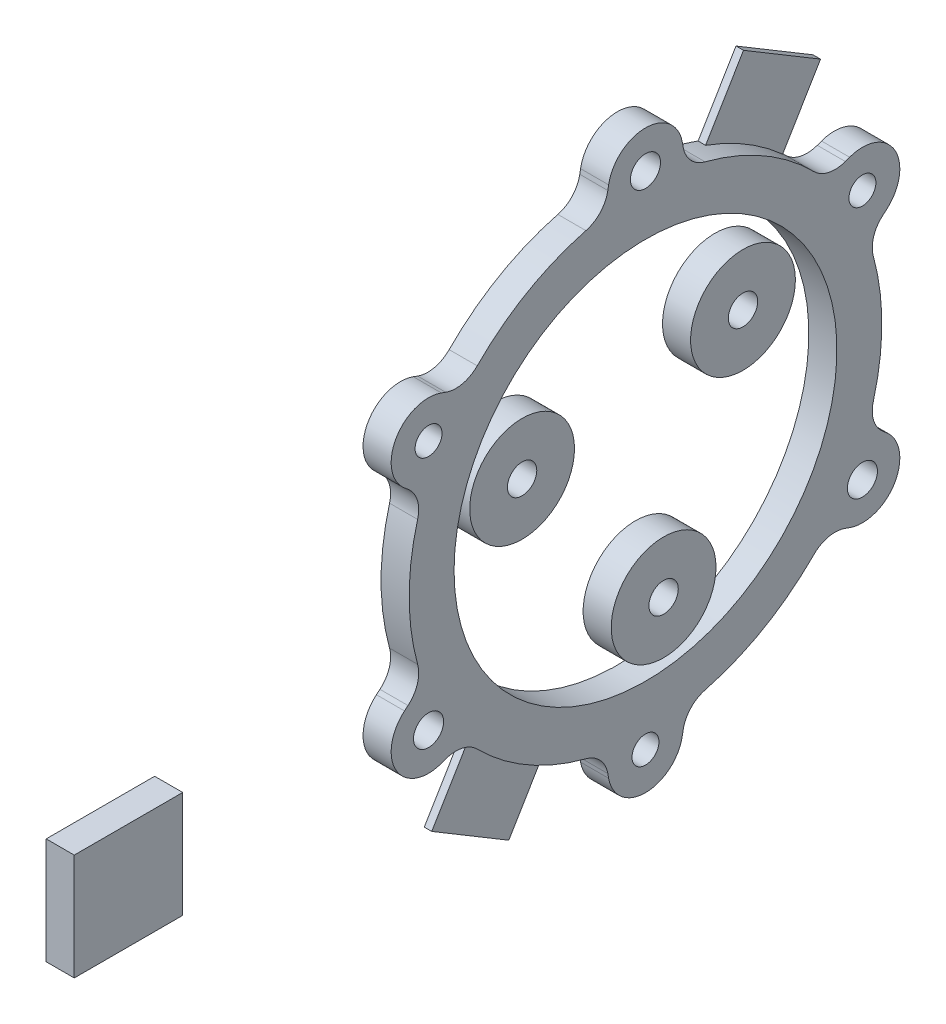
from build123d import *

# Parameters (mm, degrees)
BOSS_EXTRUDE1_DEPTH    = 4.7625
FILLET1_R              = 5.08
CIRPATTERN2_COUNT      = 6
F_10_CLEARANCE_HOLE1_D = 5.1054
SKETCH4_R              = 2.286
CUT_EXTRUDE1_DEPTH     = 66.356339539
SKETCH5_R              = 8.89
SKETCH5_R_2            = 2.4892
BOSS_EXTRUDE2_DEPTH    = 4.7625
BOSS_EXTRUDE2_2_DEPTH  = 4.7625
BOSS_EXTRUDE2_3_DEPTH  = 4.7625
SKETCH5_W              = 18.404609089
SKETCH5_H              = 18.061812119
BOSS_EXTRUDE2_4_DEPTH  = 4.7625
BOSS_EXTRUDE3_DEPTH    = 1.27


with BuildPart() as part:
    # Sketch1 → Boss-Extrude1 (new body)
    with BuildSketch(Plane(origin=(0, 0, 0), x_dir=(0, 0, -1), z_dir=(1, 0, 0))):
        with BuildLine():
            Line((6.253529232, 43.602665928), (6.978878804, 39.489004083))
            ThreePointArc((6.978878804, 39.489004083), (13.722690374, 37.679888027), (20.050475012, 34.728441437))
            Line((20.050475012, 34.728441437), (16.240475012, 28.12932786))
            ThreePointArc((16.240475012, 28.12932786), (0, 32.480950024), (-16.240475012, 28.12932786))
            Line((-16.240475012, 28.12932786), (-20.050475012, 34.728441437))
            ThreePointArc((-20.050475012, 34.728441437), (-13.722690374, 37.679888027), (-6.978878804, 39.489004083))
            Line((-6.978878804, 39.489004083), (-6.253529232, 43.602665928))
            ThreePointArc((-6.253529232, 43.602665928), (0, 48.85), (6.253529232, 43.602665928))
        make_face()
    extrude(amount=BOSS_EXTRUDE1_DEPTH)

    # Fillet1
    fillet1_edges = [part.edges().sort_by_distance(p)[0] for p in [
        (2.38125, 39.489004083, -6.978878804),
        (2.38125, 39.489004083, 6.978878804),
    ]]
    fillet(fillet1_edges, radius=FILLET1_R)


with BuildPart() as cirpattern2_1:
    # CirPattern2: pattern copy
    add(part.part.rotate(Axis((0, 0, 0), (1, 0, 0)), 1 * 360 / CIRPATTERN2_COUNT))


with BuildPart() as cirpattern2_2:
    # CirPattern2: pattern copy
    add(part.part.rotate(Axis((0, 0, 0), (1, 0, 0)), 2 * 360 / CIRPATTERN2_COUNT))


with BuildPart() as cirpattern2_3:
    # CirPattern2: pattern copy
    add(part.part.rotate(Axis((0, 0, 0), (1, 0, 0)), 3 * 360 / CIRPATTERN2_COUNT))


with BuildPart() as cirpattern2_4:
    # CirPattern2: pattern copy
    add(part.part.rotate(Axis((0, 0, 0), (1, 0, 0)), 4 * 360 / CIRPATTERN2_COUNT))


with BuildPart() as cirpattern2_5:
    # CirPattern2: pattern copy
    add(part.part.rotate(Axis((0, 0, 0), (1, 0, 0)), 5 * 360 / CIRPATTERN2_COUNT))


with BuildPart() as part_1:
    add(part.part)

    # Combine1: union CirPattern2_1, CirPattern2_2, CirPattern2_3, CirPattern2_4, CirPattern2_5
    add(cirpattern2_1.part)
    add(cirpattern2_2.part)
    add(cirpattern2_3.part)
    add(cirpattern2_4.part)
    add(cirpattern2_5.part)

    # #10 Clearance Hole1 (through all)
    with Locations(Plane(origin=(4.7625, 0, 0), x_dir=(0, 0, -1), z_dir=(1, 0, 0))):
        with Locations((0, 42.5), (36.806079661, -21.25), (-36.806079661, -21.25)):
            Hole(F_10_CLEARANCE_HOLE1_D / 2)

    # Sketch4 → Cut-Extrude1 (cut, through all)
    with BuildSketch(Plane(origin=(4.7625, 0, 0), x_dir=(0, 0, -1), z_dir=(1, 0, 0))):
        with Locations((-36.806079661, 21.25)):
            Circle(SKETCH4_R)
        with Locations((36.806079661, 21.25)):
            Circle(SKETCH4_R)
        with Locations((0, -42.5)):
            Circle(SKETCH4_R)
    extrude(amount=-CUT_EXTRUDE1_DEPTH, mode=Mode.SUBTRACT)

    # Sketch6 → Boss-Extrude3 (add)
    with BuildSketch(Plane.ZY):
        Polygon((26.764713398, -29.861954215), (13.689895201, -37.691815587), (19.699082643, -47.726352546), (32.773900841, -39.896491175), align=None)
        Polygon((-26.764713398, 29.861954215), (-13.689895201, 37.691815587), (-20.123265238, 48.434680579), (-33.198083435, 40.604819208), align=None)
    extrude(amount=-BOSS_EXTRUDE3_DEPTH)


with BuildPart() as body_2:
    # Sketch5 → Boss-Extrude2 (new body)
    with BuildSketch(Plane(origin=(4.7625, 0, 0), x_dir=(0, 0, -1), z_dir=(1, 0, 0))):
        with Locations((-20.93383019, 7.740001125)):
            Circle(SKETCH5_R)
        with Locations((-20.93383019, 7.740001125)):
            Circle(SKETCH5_R_2, mode=Mode.SUBTRACT)
    extrude(amount=-BOSS_EXTRUDE2_DEPTH)


with BuildPart() as body_3:
    # Sketch5 → Boss-Extrude2 2 (new body)
    with BuildSketch(Plane(origin=(4.7625, 0, 0), x_dir=(0, 0, -1), z_dir=(1, 0, 0))):
        with Locations((3.07529833, -21.674761439)):
            Circle(SKETCH5_R)
        with Locations((3.07529833, -21.674761439)):
            Circle(SKETCH5_R_2, mode=Mode.SUBTRACT)
    extrude(amount=-BOSS_EXTRUDE2_2_DEPTH)


with BuildPart() as body_4:
    # Sketch5 → Boss-Extrude2 3 (new body)
    with BuildSketch(Plane(origin=(4.7625, 0, 0), x_dir=(0, 0, -1), z_dir=(1, 0, 0))):
        with Locations((16.544665697, 13.825135064)):
            Circle(SKETCH5_R)
        with Locations((16.544665697, 13.825135064)):
            Circle(SKETCH5_R_2, mode=Mode.SUBTRACT)
    extrude(amount=-BOSS_EXTRUDE2_3_DEPTH)


with BuildPart() as body_5:
    # Sketch5 → Boss-Extrude2 4 (new body)
    with BuildSketch(Plane(origin=(4.7625, 0, 0), x_dir=(0, 0, -1), z_dir=(1, 0, 0))):
        with Locations((-87.72135464, -18.578840948)):
            Rectangle(SKETCH5_W, SKETCH5_H)
    extrude(amount=-BOSS_EXTRUDE2_4_DEPTH)


solid = Compound([part_1.part, body_2.part, body_3.part, body_4.part, body_5.part])
